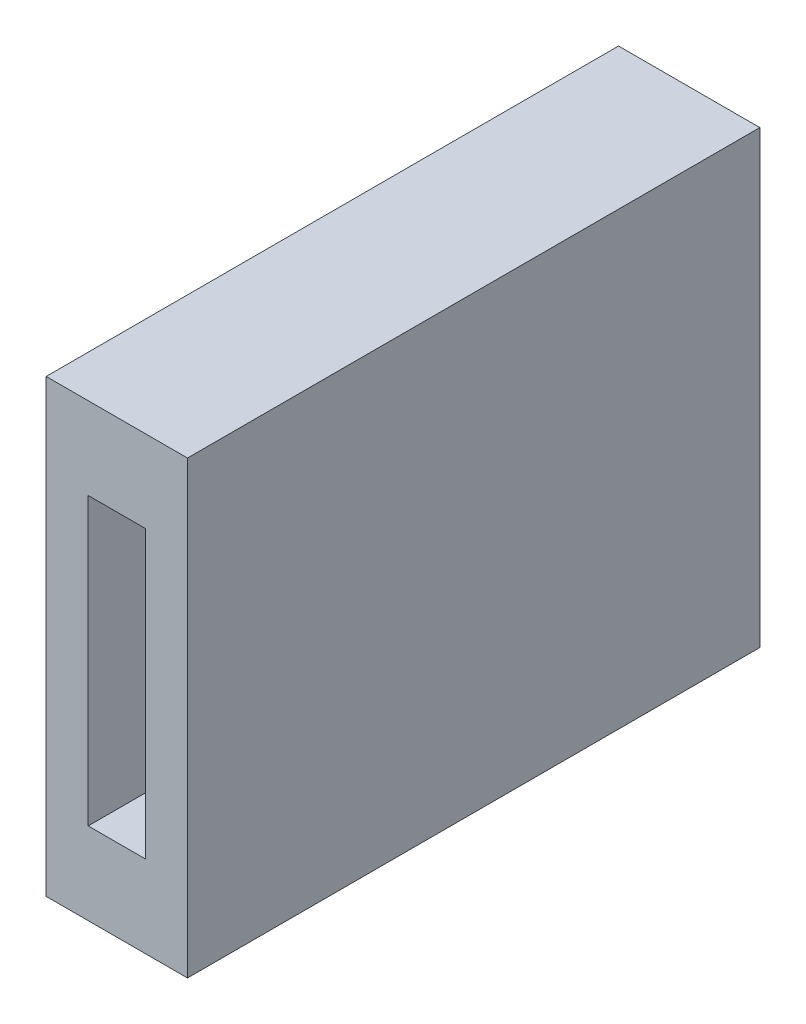
from build123d import *

# Parameters (mm, degrees)
SKETCH_1_W      = 12.34413965
SKETCH_1_H      = 39.33915212
SKETCH_1_W_2    = 5
SKETCH_1_H_2    = 25
EXTRUDE_1_DEPTH = 50


with BuildPart() as part:
    # 草图1 → 凸台-拉伸1 (new body)
    with BuildSketch(Plane.XY):
        Rectangle(SKETCH_1_W, SKETCH_1_H)
        Rectangle(SKETCH_1_W_2, SKETCH_1_H_2, mode=Mode.SUBTRACT)
    extrude(amount=EXTRUDE_1_DEPTH)


solid = part.part
